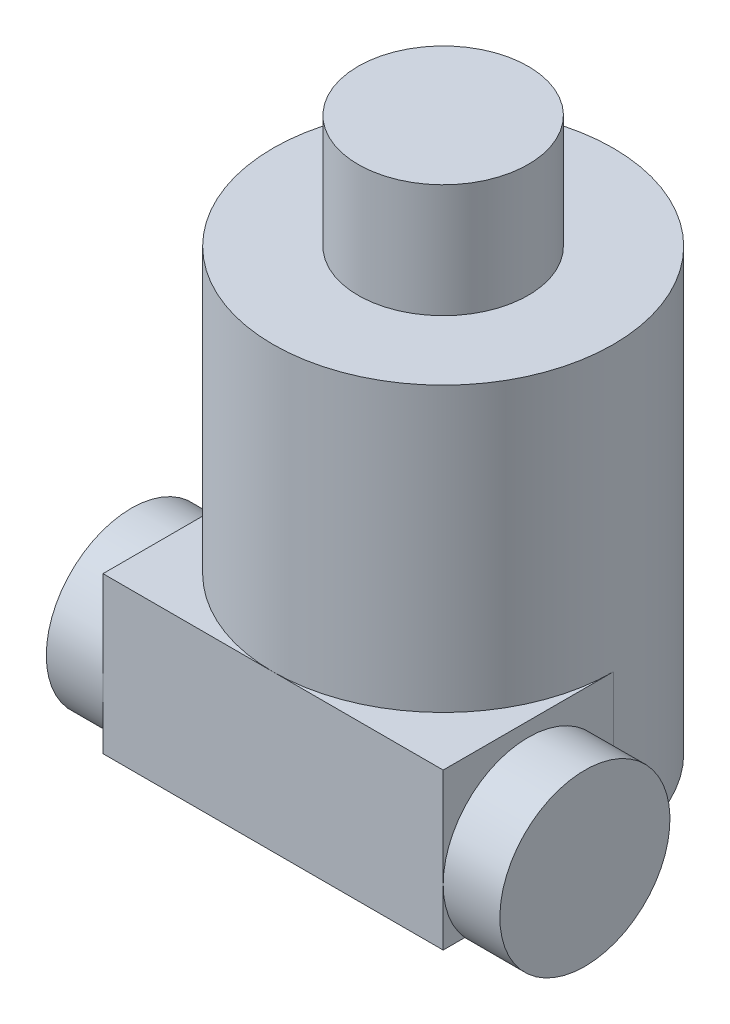
from build123d import *

# Parameters (mm, degrees)
ESQUISSE2_W        = 120
ESQUISSE2_H        = 60
BOSS_EXTRU_1_DEPTH = 55
ESQUISSE3_R        = 30
BOSS_EXTRU_2_DEPTH = 20


with BuildPart() as part:
    # Esquisse1 → Révolution1 (revolve)
    with BuildSketch(Plane.XY):
        Polygon((0, 0), (-60, 0), (-60, 155), (-30, 155), (-30, 195), (0, 195), align=None)
    revolve(axis=Axis((0, 195, 0), (0, -1, 0)))

    # Esquisse2 → Boss.-Extru.1 (add)
    with BuildSketch(Plane.XZ):
        with Locations((0, 30)):
            Rectangle(ESQUISSE2_W, ESQUISSE2_H)
    extrude(amount=-BOSS_EXTRU_1_DEPTH)

    # Esquisse3 → Boss.-Extru.2 (add)
    with BuildSketch(Plane.ZY.offset(60)):
        with Locations((30, 20)):
            Circle(ESQUISSE3_R)
    boss_extru_2 = extrude(amount=BOSS_EXTRU_2_DEPTH)

    # Symétrie1: Boss.-Extru.2 across plane
    add(boss_extru_2.mirror(Plane(origin=(0, 0, 0), x_dir=(0, 0, 1), z_dir=(1, 0, 0))))


solid = part.part
